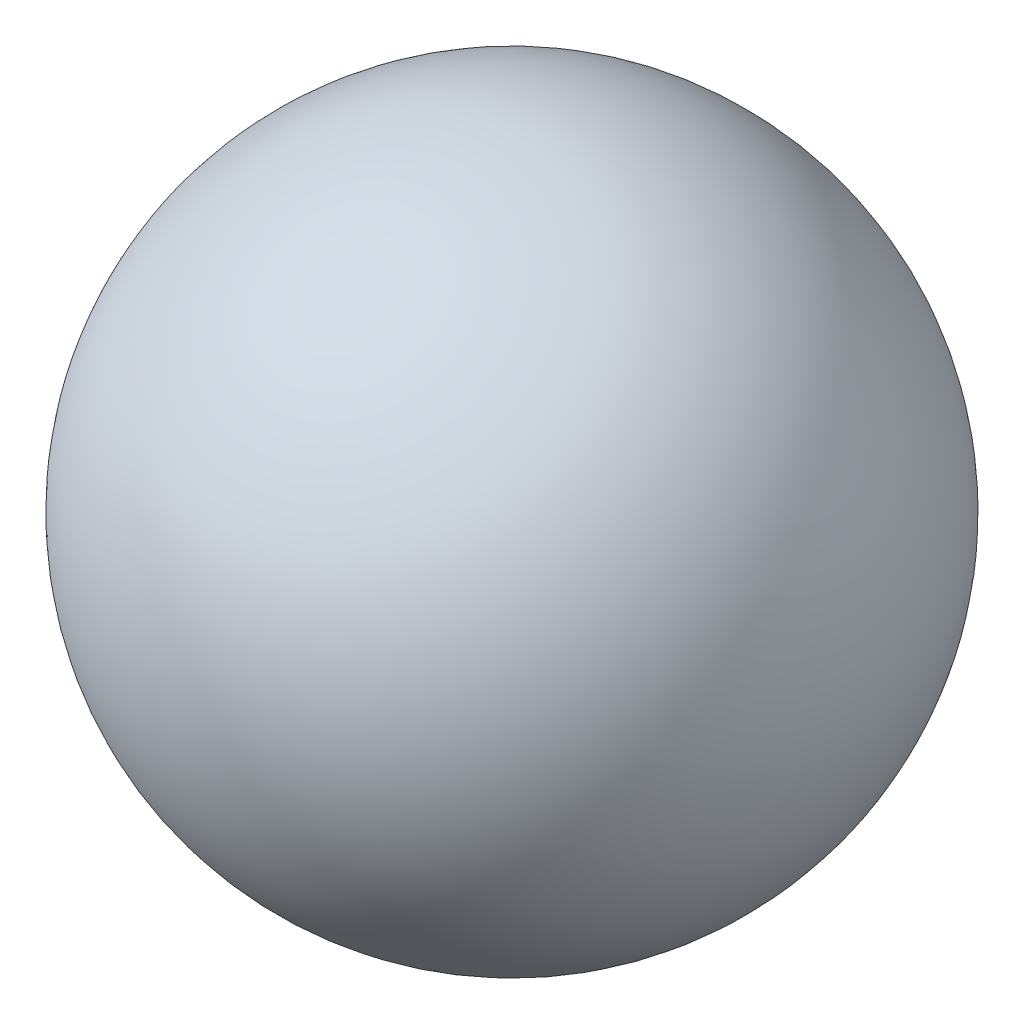
from build123d import *


with BuildPart() as part:
    # Sketch1 → Revolve1 (revolve)
    with BuildSketch(Plane.XY):
        with BuildLine():
            Line((-4.76, 0), (4.76, 0))
            ThreePointArc((4.76, 0), (0, 4.76), (-4.76, 0))
        make_face()
    revolve(axis=Axis((-4.76, 0, 0), (1, 0, 0)))


solid = part.part
